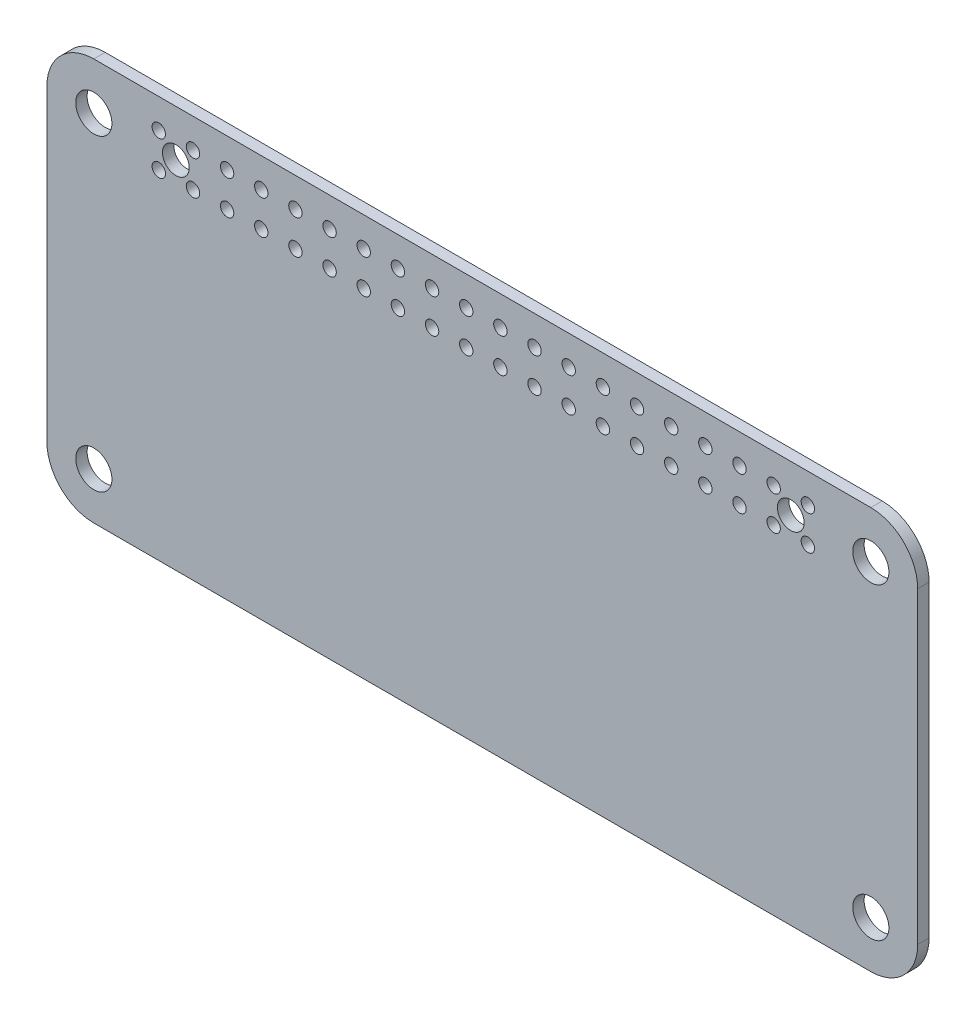
from build123d import *

# Parameters (mm, degrees)
SKETCH_1_W          = 65
SKETCH_1_H          = 30
EXTRUDE_1_DEPTH     = 0.85
FILLET_1_R          = 3.5
HOLE_WIZARD_M2_1_D  = 2.7
SKETCH_6_R          = 0.5
SKETCH_6_R_2        = 1
CUT_EXTRUDE_1_DEPTH = 67.971803768


with BuildPart() as part:
    # 草图1 → 凸台-拉伸1 (new body)
    with BuildSketch(Plane.XY):
        with Locations((29, -11.5)):
            Rectangle(SKETCH_1_W, SKETCH_1_H)
    extrude(amount=EXTRUDE_1_DEPTH)

    # 圆角1
    fillet_1_edges = [part.edges().sort_by_distance(p)[0] for p in [
        (-3.5, 3.5, 0.425),
        (61.5, 3.5, 0.425),
        (61.5, -26.5, 0.425),
        (-3.5, -26.5, 0.425),
    ]]
    fillet(fillet_1_edges, radius=FILLET_1_R)

    # M2 间隙孔1 (through all)
    with Locations(Plane.XY.offset(0.85)):
        with Locations((0, 0), (58, 0), (58, -23), (0, -23)):
            Hole(HOLE_WIZARD_M2_1_D / 2)

    # 草图6 → 切除-拉伸1 (cut, through all)
    with BuildSketch(Plane(origin=(0, 0, 0), x_dir=(-1, 0, 0), z_dir=(0, 0, -1))):
        with Locations((-4.85, 1.3)):
            Circle(SKETCH_6_R)
        with Locations((-4.85, -1.25)):
            Circle(SKETCH_6_R)
        with Locations((-7.4, -1.25)):
            Circle(SKETCH_6_R)
        with Locations((-7.4, 1.3)):
            Circle(SKETCH_6_R)
        with Locations((-9.95, 1.3)):
            Circle(SKETCH_6_R)
        with Locations((-9.95, -1.25)):
            Circle(SKETCH_6_R)
        with Locations((-12.5, -1.25)):
            Circle(SKETCH_6_R)
        with Locations((-12.5, 1.3)):
            Circle(SKETCH_6_R)
        with Locations((-15.05, 1.3)):
            Circle(SKETCH_6_R)
        with Locations((-15.05, -1.25)):
            Circle(SKETCH_6_R)
        with Locations((-17.6, -1.25)):
            Circle(SKETCH_6_R)
        with Locations((-17.6, 1.3)):
            Circle(SKETCH_6_R)
        with Locations((-20.15, 1.3)):
            Circle(SKETCH_6_R)
        with Locations((-20.15, -1.25)):
            Circle(SKETCH_6_R)
        with Locations((-22.7, -1.25)):
            Circle(SKETCH_6_R)
        with Locations((-22.7, 1.3)):
            Circle(SKETCH_6_R)
        with Locations((-25.25, 1.3)):
            Circle(SKETCH_6_R)
        with Locations((-25.25, -1.25)):
            Circle(SKETCH_6_R)
        with Locations((-27.8, -1.25)):
            Circle(SKETCH_6_R)
        with Locations((-27.8, 1.3)):
            Circle(SKETCH_6_R)
        with Locations((-30.35, 1.3)):
            Circle(SKETCH_6_R)
        with Locations((-30.35, -1.25)):
            Circle(SKETCH_6_R)
        with Locations((-32.9, -1.25)):
            Circle(SKETCH_6_R)
        with Locations((-32.9, 1.3)):
            Circle(SKETCH_6_R)
        with Locations((-35.45, 1.3)):
            Circle(SKETCH_6_R)
        with Locations((-35.45, -1.25)):
            Circle(SKETCH_6_R)
        with Locations((-38, -1.25)):
            Circle(SKETCH_6_R)
        with Locations((-38, 1.3)):
            Circle(SKETCH_6_R)
        with Locations((-40.55, 1.3)):
            Circle(SKETCH_6_R)
        with Locations((-40.55, -1.25)):
            Circle(SKETCH_6_R)
        with Locations((-43.1, -1.25)):
            Circle(SKETCH_6_R)
        with Locations((-43.1, 1.3)):
            Circle(SKETCH_6_R)
        with Locations((-45.65, 1.3)):
            Circle(SKETCH_6_R)
        with Locations((-45.65, -1.25)):
            Circle(SKETCH_6_R)
        with Locations((-48.2, -1.25)):
            Circle(SKETCH_6_R)
        with Locations((-48.2, 1.3)):
            Circle(SKETCH_6_R)
        with Locations((-50.75, 1.3)):
            Circle(SKETCH_6_R)
        with Locations((-50.75, -1.25)):
            Circle(SKETCH_6_R)
        with Locations((-53.3, -1.25)):
            Circle(SKETCH_6_R)
        with Locations((-53.3, 1.3)):
            Circle(SKETCH_6_R)
        with Locations((-6.125, 0.025)):
            Circle(SKETCH_6_R_2)
        with Locations((-52.025, 0.025)):
            Circle(SKETCH_6_R_2)
    extrude(amount=-CUT_EXTRUDE_1_DEPTH, mode=Mode.SUBTRACT)


solid = part.part
